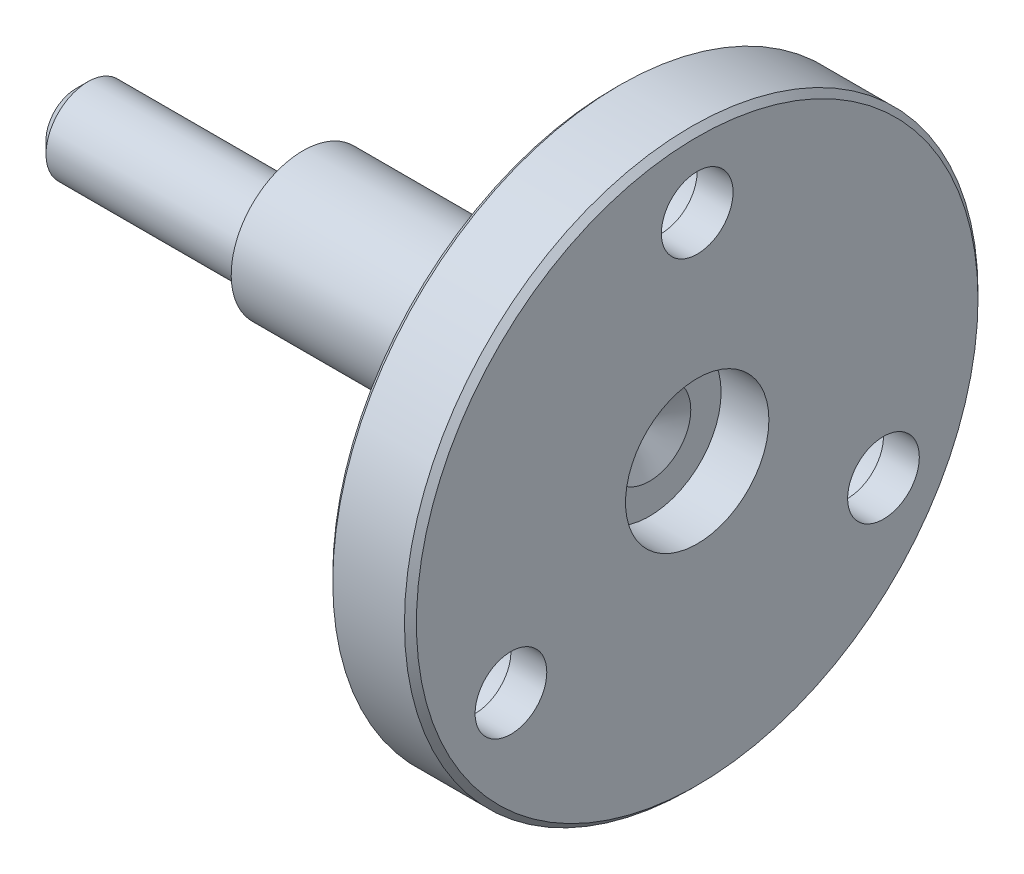
from build123d import *

# Parameters (mm, degrees)
CHANFREIN2_SIZE              = 0.5
R_P_TITION_CIRCULAIRE1_COUNT = 3


with BuildPart() as part:
    # Esquisse1 → Base-Révolution (revolve)
    with BuildSketch(Plane.XY, mode=Mode.PRIVATE) as base_r_volution_sk:
        with BuildLine():
            Line((-33, 0), (-33, 6))
            Line((-33, 6), (-11, 6))
            Line((-11, 6), (-11, 8))
            Line((-11, 8), (-10, 8))
            ThreePointArc((-10, 8), (-7.878679656, 8.878679656), (-7, 11))
            Line((-7, 11), (-7, 24))
            Line((-7, 24), (0, 24))
            Line((0, 24), (0, 6))
            Line((0, 6), (-4, 6))
            Line((-4, 6), (-4, 3.464101615))
            Line((-4, 3.464101615), (-6, 0))
            Line((-6, 0), (-33, 0))
        make_face()
    revolve(base_r_volution_sk.sketch.rotate(Axis((0, 0, 0), (-1, 0, 0)), 90), axis=Axis((0, 0, 0), (-1, 0, 0)))

    # Chanfrein2
    chanfrein2_edges = [part.edges().sort_by_distance(p)[0] for p in [
        (0, 0, 24),
        (-7, 0, 24),
    ]]
    chamfer(chanfrein2_edges, length=CHANFREIN2_SIZE)

    # Esquisse2 → Boss.-Révol.1 (revolve)
    with BuildSketch(Plane.XY):
        Polygon((-28, 3), (-33, 3), (-34, 2), (-51, 2), (-52, 1), (-52, -1.5), (-28, -1.5), align=None)
    revolve(axis=Axis((-19, -1.5, 0), (-1, 0, 0)))

    # Esquisse3 → Enlèvement de matière-Révolution2 (revolve, cut)
    with BuildSketch(Plane.XY, mode=Mode.PRIVATE) as enl_vement_de_mati_re_r_volution2_sk:
        Polygon((-8, 23), (-3, 23), (-3, 21), (4, 21), (4, 18), (-8, 18), align=None)
    enl_vement_de_mati_re_r_volution2 = revolve(enl_vement_de_mati_re_r_volution2_sk.sketch.rotate(Axis((-12, 18, 0), (1, 0, 0)), 90), axis=Axis((-12, 18, 0), (1, 0, 0)), mode=Mode.SUBTRACT)

    # Répétition circulaire1: Enlèvement de matière-Révolution2 ×3 about axis
    r_p_tition_circulaire1_axis = Axis((0, 0, 0), (1, 0, 0))
    for i in range(1, R_P_TITION_CIRCULAIRE1_COUNT):
        add(enl_vement_de_mati_re_r_volution2.rotate(r_p_tition_circulaire1_axis, i * 360 / R_P_TITION_CIRCULAIRE1_COUNT), mode=Mode.SUBTRACT)


solid = part.part
